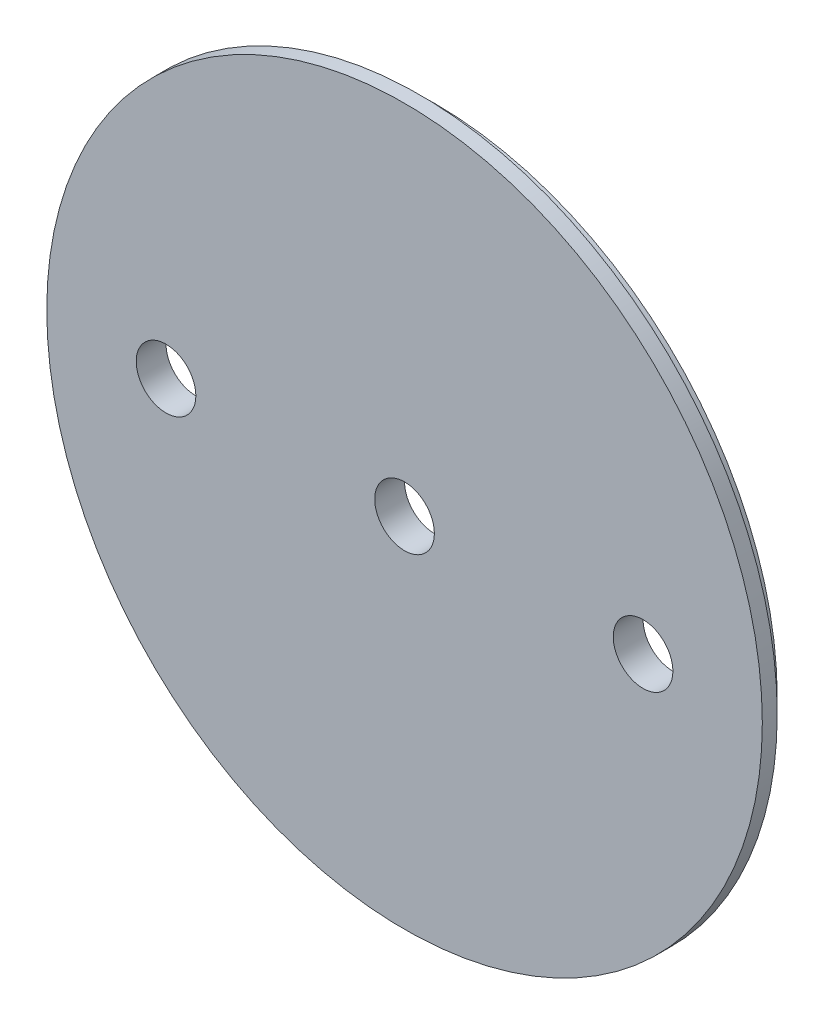
from build123d import *

# Parameters (mm, degrees)
SKETCH1_R           = 38.1
BOSS_EXTRUDE1_DEPTH = 3.175
SKETCH2_R           = 38.1
SKETCH2_R_2         = 36.5125
CUT_EXTRUDE1_DEPTH  = 1.5875
SKETCH3_R           = 3.175
CUT_EXTRUDE2_DEPTH  = 54.975


with BuildPart() as part:
    # Sketch1 → Boss-Extrude1 (new body)
    with BuildSketch(Plane.XY):
        Circle(SKETCH1_R)
    extrude(amount=BOSS_EXTRUDE1_DEPTH)

    # Sketch2 → Cut-Extrude1 (cut)
    with BuildSketch(Plane(origin=(0, 0, 0), x_dir=(-1, 0, 0), z_dir=(0, 0, -1))):
        Circle(SKETCH2_R)
        Circle(SKETCH2_R_2, mode=Mode.SUBTRACT)
    extrude(amount=-CUT_EXTRUDE1_DEPTH, mode=Mode.SUBTRACT)

    # Sketch3 → Cut-Extrude2 (cut, through all)
    with BuildSketch(Plane.XY.offset(3.175)):
        Circle(SKETCH3_R)
        with Locations((25.4, 0)):
            Circle(SKETCH3_R)
        with Locations((-25.4, 0)):
            Circle(SKETCH3_R)
    extrude(amount=-CUT_EXTRUDE2_DEPTH, mode=Mode.SUBTRACT)


solid = part.part
